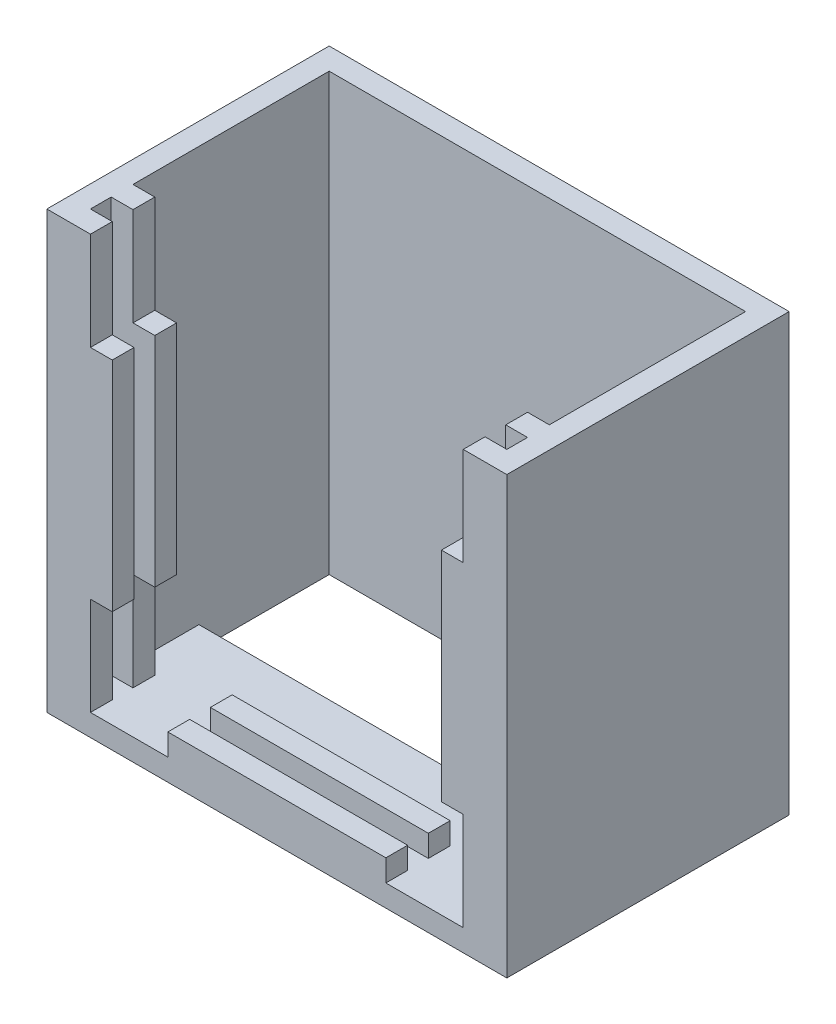
from build123d import *

# Parameters (mm, degrees)
BOSS_EXTRUDE1_DEPTH   = 38
BOSS_EXTRUDE1_2_DEPTH = 38
SKETCH2_W             = 42.2
SKETCH2_H             = 5.9
BOSS_EXTRUDE2_DEPTH   = 2
BOSS_EXTRUDE3_DEPTH   = 18
SKETCH4_W             = 42.2
SKETCH4_H             = 40
BOSS_EXTRUDE4_DEPTH   = 2
SKETCH5_W             = 38.2
SKETCH5_H             = 11.95
CUT_EXTRUDE1_DEPTH    = 81.281509747
SKETCH6_W             = 2
SKETCH6_H             = 10
BOSS_EXTRUDE5_DEPTH   = 2
SKETCH7_W             = 2
SKETCH7_H             = 10
BOSS_EXTRUDE6_DEPTH   = 2
SKETCH8_W             = 10
SKETCH8_H             = 2
BOSS_EXTRUDE7_DEPTH   = 2


with BuildPart() as part:
    # Sketch1 → Boss-Extrude1 (new body)
    with BuildSketch(Plane(origin=(0, 0, 0), x_dir=(1, 0, 0), z_dir=(0, 1, 0))):
        Polygon((-62.898983402, -26.09346473), (-62.898983402, -24.19346473), (-60.898983402, -24.19346473), (-60.898983402, -22.19346473), (-64.898983402, -22.19346473), (-64.898983402, -28.09346473), (-60.898983402, -28.09346473), (-60.898983402, -26.09346473), align=None)
    extrude(amount=BOSS_EXTRUDE1_DEPTH)



with BuildPart() as body_2:
    # Sketch1 → Boss-Extrude1 2 (new body)
    with BuildSketch(Plane(origin=(0, 0, 0), x_dir=(1, 0, 0), z_dir=(0, 1, 0))):
        Polygon((-26.698983402, -22.19346473), (-26.698983402, -24.19346473), (-24.698983402, -24.19346473), (-24.698983402, -26.09346473), (-26.698983402, -26.09346473), (-26.698983402, -28.09346473), (-22.698983402, -28.09346473), (-22.698983402, -22.19346473), align=None)
    extrude(amount=BOSS_EXTRUDE1_2_DEPTH)


with BuildPart() as part_1:
    add(part.part)

    add(body_2.part)  # Boss-Extrude2 merges body 2
    # Sketch2 → Boss-Extrude2 (add)
    with BuildSketch(Plane(origin=(0, 0, 0), x_dir=(1, 0, 0), z_dir=(0, 1, 0))):
        with Locations((-43.798983402, -25.14346473)):
            Rectangle(SKETCH2_W, SKETCH2_H)
    extrude(amount=-BOSS_EXTRUDE2_DEPTH)

    # Sketch3 → Boss-Extrude3 (add)
    with BuildSketch(Plane(origin=(0, 0, 22.19346473), x_dir=(-1, 0, 0), z_dir=(0, 0, -1))):
        Polygon((24.698983402, 38), (22.698983402, 38), (22.698983402, -2), (64.898983402, -2), (64.898983402, 38), (62.898983402, 38), (62.898983402, 0), (24.698983402, 0), align=None)
    extrude(amount=BOSS_EXTRUDE3_DEPTH)

    # Sketch4 → Boss-Extrude4 (add)
    with BuildSketch(Plane(origin=(0, 0, 4.19346473), x_dir=(-1, 0, 0), z_dir=(0, 0, -1))):
        with Locations((43.798983402, 18)):
            Rectangle(SKETCH4_W, SKETCH4_H)
    extrude(amount=BOSS_EXTRUDE4_DEPTH)

    # Sketch5 → Cut-Extrude1 (cut, through all)
    with BuildSketch(Plane(origin=(0, 0, 0), x_dir=(1, 0, 0), z_dir=(0, 1, 0))):
        with Locations((-43.798983402, -10.16846473)):
            Rectangle(SKETCH5_W, SKETCH5_H)
    extrude(amount=-CUT_EXTRUDE1_DEPTH, mode=Mode.SUBTRACT)

    # Sketch6 → Boss-Extrude5 (add)
    with BuildSketch(Plane(origin=(-60.898983402, 0, 0), x_dir=(0, 0, -1), z_dir=(1, 0, 0))):
        with Locations((-27.09346473, 24)):
            Rectangle(SKETCH6_W, SKETCH6_H)
        with Locations((-23.19346473, 24)):
            Rectangle(SKETCH6_W, SKETCH6_H)
        with Locations((-27.09346473, 14)):
            Rectangle(SKETCH6_W, SKETCH6_H)
        with Locations((-23.19346473, 14)):
            Rectangle(SKETCH6_W, SKETCH6_H)
    extrude(amount=BOSS_EXTRUDE5_DEPTH)

    # Sketch7 → Boss-Extrude6 (add)
    with BuildSketch(Plane.ZY.offset(26.698983402)):
        with Locations((27.09346473, 24)):
            Rectangle(SKETCH7_W, SKETCH7_H)
        with Locations((27.09346473, 14)):
            Rectangle(SKETCH7_W, SKETCH7_H)
        with Locations((23.19346473, 14)):
            Rectangle(SKETCH7_W, SKETCH7_H)
        with Locations((23.19346473, 24)):
            Rectangle(SKETCH7_W, SKETCH7_H)
    extrude(amount=BOSS_EXTRUDE6_DEPTH)

    # Sketch8 → Boss-Extrude7 (add)
    with BuildSketch(Plane(origin=(0, 0, 0), x_dir=(1, 0, 0), z_dir=(0, 1, 0))):
        with Locations((-48.798983402, -23.19346473)):
            Rectangle(SKETCH8_W, SKETCH8_H)
        with Locations((-38.798983402, -23.19346473)):
            Rectangle(SKETCH8_W, SKETCH8_H)
        with Locations((-48.798983402, -27.09346473)):
            Rectangle(SKETCH8_W, SKETCH8_H)
        with Locations((-38.798983402, -27.09346473)):
            Rectangle(SKETCH8_W, SKETCH8_H)
    extrude(amount=BOSS_EXTRUDE7_DEPTH)


solid = part_1.part
